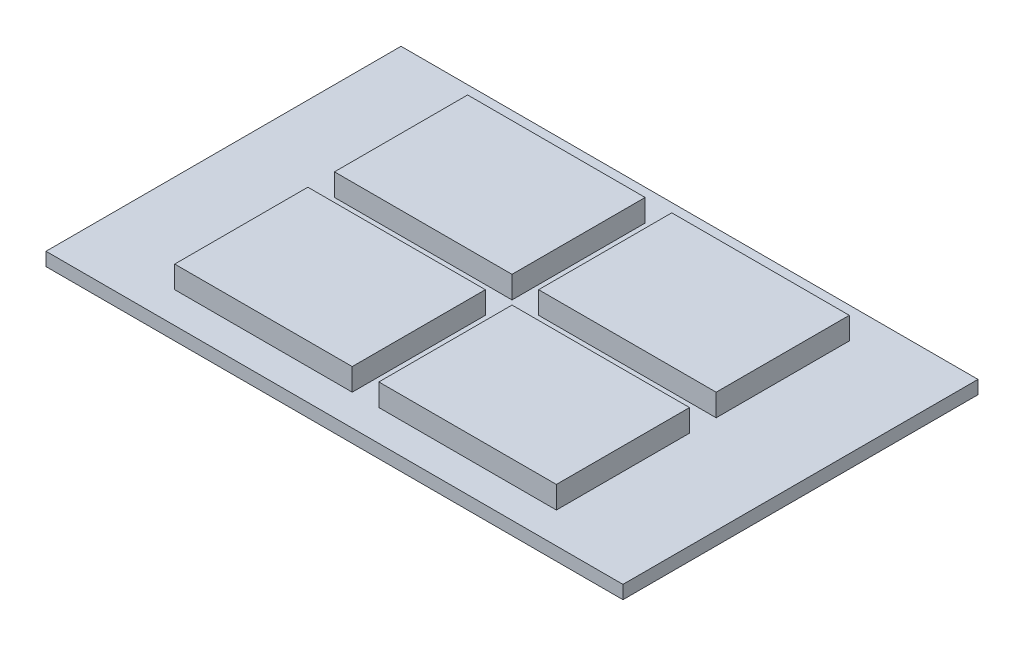
from build123d import *

# Parameters (mm, degrees)
SKETCH1_W           = 130
SKETCH1_H           = 80
BOSS_EXTRUDE1_DEPTH = 3
SKETCH2_W           = 40
SKETCH2_H           = 30
BOSS_EXTRUDE2_DEPTH = 5


with BuildPart() as part:
    # Sketch1 → Boss-Extrude1 (new body)
    with BuildSketch(Plane(origin=(0, 0, 0), x_dir=(1, 0, 0), z_dir=(0, 1, 0))):
        Rectangle(SKETCH1_W, SKETCH1_H)
    extrude(amount=BOSS_EXTRUDE1_DEPTH)

    # Sketch2 → Boss-Extrude2 (add)
    with BuildSketch(Plane(origin=(0, 3, 0), x_dir=(1, 0, 0), z_dir=(0, 1, 0))):
        with Locations((-23, 18)):
            Rectangle(SKETCH2_W, SKETCH2_H)
        with Locations((23, 18)):
            Rectangle(SKETCH2_W, SKETCH2_H)
        with Locations((23, -18)):
            Rectangle(SKETCH2_W, SKETCH2_H)
        with Locations((-23, -18)):
            Rectangle(SKETCH2_W, SKETCH2_H)
    extrude(amount=BOSS_EXTRUDE2_DEPTH)


solid = part.part
